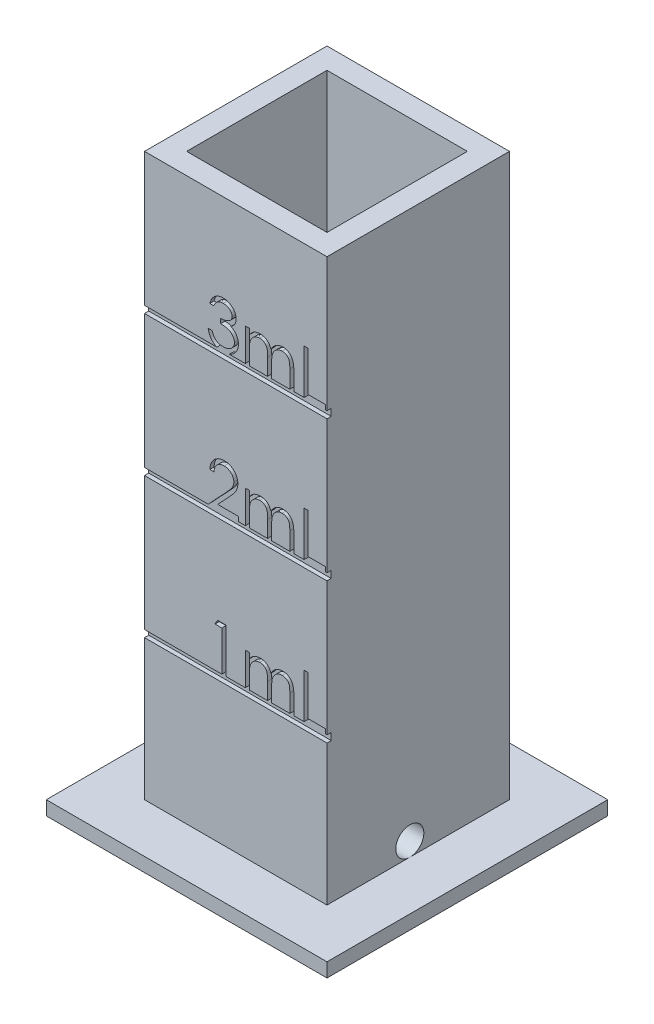
from build123d import *

# Parameters (mm, degrees)
SKETCH1_W               = 13
SKETCH1_H               = 13
SKETCH1_W_2             = 10
SKETCH1_H_2             = 10
BOSS_EXTRUDE1_DEPTH     = 40
SKETCH2_W               = 13
SKETCH2_H               = 0.5
CUT_EXTRUDE1_DEPTH      = 0.3
SKETCH3_W               = 20
SKETCH3_H               = 20
BOSS_EXTRUDE2_DEPTH     = 1
CUT_EXTRUDE3_DEPTH      = 5
CUT_EXTRUDE3_DEPTH_BACK = 21
SKETCH4_R               = 1
CUT_EXTRUDE4_DEPTH      = 0.3


with BuildPart() as part:
    # Sketch1 → Boss-Extrude1 (new body)
    with BuildSketch(Plane(origin=(0, 0, 0), x_dir=(1, 0, 0), z_dir=(0, 1, 0))):
        Rectangle(SKETCH1_W, SKETCH1_H)
        Rectangle(SKETCH1_W_2, SKETCH1_H_2, mode=Mode.SUBTRACT)
    extrude(amount=BOSS_EXTRUDE1_DEPTH)

    # Sketch2 → Cut-Extrude1 (cut)
    with BuildSketch(Plane.XY.offset(6.5)):
        with Locations((0, 10.25)):
            Rectangle(SKETCH2_W, SKETCH2_H)
        with Locations((0, 20.25)):
            Rectangle(SKETCH2_W, SKETCH2_H)
        with Locations((0, 30.25)):
            Rectangle(SKETCH2_W, SKETCH2_H)
        with Locations((0, 40.25)):
            Rectangle(SKETCH2_W, SKETCH2_H)
        with Locations((0, 50.25)):
            Rectangle(SKETCH2_W, SKETCH2_H)
        with Locations((0, 60.25)):
            Rectangle(SKETCH2_W, SKETCH2_H)
    extrude(amount=-CUT_EXTRUDE1_DEPTH, mode=Mode.SUBTRACT)

    # Sketch3 → Boss-Extrude2 (add)
    with BuildSketch(Plane.XZ):
        Rectangle(SKETCH3_W, SKETCH3_H)
    extrude(amount=BOSS_EXTRUDE2_DEPTH)

    # Sketch4 → Cut-Extrude3 (cut, two sides: drawn at the far end of the back side and taken through both)
    with BuildSketch(Plane(origin=(6.5, 0, 0), x_dir=(0, 0, -1), z_dir=(1, 0, 0)).offset(-CUT_EXTRUDE3_DEPTH_BACK)):
        with Locations(Location((-0.601324877, 1, 0), (0, 0, 270))):
            Circle(SKETCH4_R)
    extrude(amount=CUT_EXTRUDE3_DEPTH + CUT_EXTRUDE3_DEPTH_BACK, mode=Mode.SUBTRACT)

    # Sketch5 → Cut-Extrude4 (cut)
    with BuildSketch(Plane.XY.offset(6.5)):
        Polygon((4.871794872, 13.675), (5.156730769, 13.675), (5.156730769, 10.825641026), (6.377884615, 10.825641026), (6.377884615, 10.5), (4.871794872, 10.5), align=None)
        with BuildLine():
            Line((0.679166667, 12.820192308), (0.964102564, 12.820192308))
            Line((0.964102564, 12.820192308), (0.964102564, 12.416957131))
            add(Edge.make_bspline(
                [(0.964102564, 12.416957131), (0.989760147, 12.452233742), (1.038922536, 12.519827109), (1.119536378, 12.608899724), (1.200068995, 12.684490264), (1.258065705, 12.724171297), (1.285927484, 12.743234175)],
                knots=[0, 0, 0, 0, 1.134379233, 2.173579362, 3.122582517, 4, 4, 4, 4], degree=3))
            add(Edge.make_bspline(
                [(1.285927484, 12.743234175), (1.323904713, 12.761381899), (1.399195665, 12.797360285), (1.518411676, 12.833857871), (1.640399412, 12.85628707), (1.722775435, 12.859354459), (1.76421274, 12.860897436)],
                knots=[0, 0, 0, 0, 1.014936303, 2.012140481, 3.000054389, 4, 4, 4, 4], degree=3))
            add(Edge.make_bspline(
                [(1.76421274, 12.860897436), (1.792237102, 12.859949208), (1.847695805, 12.858072715), (1.929868516, 12.845862541), (2.009568828, 12.824756798), (2.08632584, 12.795358726), (2.158643885, 12.759756374), (2.224946229, 12.71798271), (2.28447676, 12.671086078), (2.337205393, 12.61694876), (2.384620866, 12.55405056), (2.428235248, 12.480695134), (2.468535262, 12.395235327), (2.490870306, 12.333217108), (2.502629207, 12.300565905)],
                knots=[0, 0, 0, 0, 1.009824226, 1.998387844, 2.986035974, 3.974953746, 4.955485308, 5.885931332, 6.793869504, 7.679848016, 8.601185859, 9.625726857, 10.749998409, 12, 12, 12, 12], degree=3))
            add(Edge.make_bspline(
                [(2.502629207, 12.300565905), (2.51506727, 12.322994486), (2.539543633, 12.367130782), (2.580642318, 12.429595063), (2.623702391, 12.488021224), (2.669090824, 12.542455623), (2.716647413, 12.59262945), (2.766595969, 12.63870859), (2.818652164, 12.680890926), (2.891035124, 12.730169792), (2.98520799, 12.782513007), (3.103942208, 12.827895953), (3.227449864, 12.855941298), (3.311285918, 12.859234474), (3.353620793, 12.860897436)],
                knots=[0, 0, 0, 0, 0.86119277, 1.694706429, 2.50939023, 3.298075842, 4.073795165, 4.829715201, 5.57930267, 6.321991688, 7.768977793, 9.186738141, 10.579381044, 12, 12, 12, 12], degree=3))
            add(Edge.make_bspline(
                [(3.353620793, 12.860897436), (3.392520406, 12.859430386), (3.468650725, 12.856559226), (3.579482959, 12.834013575), (3.682844454, 12.795298852), (3.77852723, 12.742472625), (3.864850775, 12.676088651), (3.939886284, 12.597104777), (4.003177971, 12.506079683), (4.044524308, 12.420452665), (4.072568869, 12.344855613), (4.089860132, 12.280442763), (4.105136141, 12.20954814), (4.117819128, 12.132086974), (4.127088814, 12.047785637), (4.133956535, 11.956782085), (4.138604801, 11.859005591), (4.138933253, 11.791545459), (4.139102564, 11.756770833)],
                knots=[0, 0, 0, 0, 1.209669288, 2.367440248, 3.500751976, 4.631527125, 5.755587489, 6.87532382, 8.007944318, 9.190864318, 9.82315674, 10.514484317, 11.263564316, 12.079023757, 12.955305781, 13.901327259, 14.918167583, 16, 16, 16, 16], degree=3))
            Line((4.139102564, 11.756770833), (4.139102564, 10.5))
            Line((4.139102564, 10.5), (3.854166667, 10.5))
            Line((3.854166667, 10.5), (3.854166667, 11.758042869))
            add(Edge.make_bspline(
                [(3.854166667, 11.758042869), (3.854096016, 11.787725104), (3.853960235, 11.844769845), (3.851516727, 11.926641711), (3.846912692, 12.001270864), (3.841529127, 12.068555544), (3.834050814, 12.128652659), (3.824393433, 12.181441496), (3.814162966, 12.227337311), (3.797166746, 12.278215368), (3.76999973, 12.334340488), (3.728618158, 12.394868303), (3.676484562, 12.447555886), (3.61628642, 12.493292502), (3.547753188, 12.530479591), (3.472220189, 12.557037114), (3.390156371, 12.573477153), (3.333348556, 12.575115467), (3.304011418, 12.575961538)],
                knots=[0, 0, 0, 0, 1.253487763, 2.409012846, 3.458416907, 4.410876679, 5.259312806, 6.014470957, 6.676830364, 7.243083969, 8.276244668, 9.299465089, 10.325150304, 11.392391894, 12.482080715, 13.603491619, 14.762376348, 16, 16, 16, 16], degree=3))
            add(Edge.make_bspline(
                [(3.304011418, 12.575961538), (3.268025103, 12.574676881), (3.196902462, 12.572137911), (3.093084056, 12.546217326), (2.993324634, 12.507137384), (2.900600906, 12.450502227), (2.815304268, 12.382640354), (2.741916794, 12.301950363), (2.681290454, 12.210664644), (2.640238633, 12.126167278), (2.614304052, 12.05026714), (2.597179993, 11.983957381), (2.583860059, 11.90859053), (2.571368222, 11.824673021), (2.563215069, 11.731627214), (2.555805188, 11.629883522), (2.55233912, 11.51913593), (2.551854289, 11.442367434), (2.551602564, 11.402509014)],
                knots=[0, 0, 0, 0, 1.090531906, 2.155305635, 3.229839962, 4.33261226, 5.44038871, 6.529323825, 7.629011124, 8.757537029, 9.370236727, 10.061839251, 10.834451254, 11.692844982, 12.636905849, 13.66920014, 14.789842145, 16, 16, 16, 16], degree=3))
            Line((2.551602564, 11.402509014), (2.551602564, 10.5))
            Line((2.551602564, 10.5), (2.266666667, 10.5))
            Line((2.266666667, 10.5), (2.266666667, 11.6798127))
            add(Edge.make_bspline(
                [(2.266666667, 11.6798127), (2.266594611, 11.713098782), (2.266455984, 11.777137859), (2.264028182, 11.868971264), (2.25941389, 11.952501958), (2.254079392, 12.027632857), (2.246404802, 12.09422742), (2.237687375, 12.152642665), (2.227392564, 12.202732146), (2.210347454, 12.257671788), (2.184299329, 12.318197197), (2.142399977, 12.382732266), (2.090141672, 12.439218326), (2.028845235, 12.487440905), (1.959897223, 12.527302106), (1.883712281, 12.556022023), (1.800976396, 12.572735486), (1.743937334, 12.574865908), (1.714603365, 12.575961538)],
                knots=[0, 0, 0, 0, 1.320475261, 2.540461679, 3.643808994, 4.639130445, 5.527981419, 6.302341397, 6.981980563, 7.553956391, 8.582137848, 9.585246428, 10.591171744, 11.620968678, 12.668337649, 13.738356861, 14.836885341, 16, 16, 16, 16], degree=3))
            add(Edge.make_bspline(
                [(1.714603365, 12.575961538), (1.680117231, 12.574573193), (1.611387589, 12.571806269), (1.510420802, 12.54690132), (1.412915932, 12.507890481), (1.320428455, 12.453770502), (1.235452621, 12.386733481), (1.161059407, 12.307889254), (1.098518687, 12.218219059), (1.057033398, 12.134612676), (1.030274068, 12.060614063), (1.0124983, 11.997702846), (0.997222354, 11.927852621), (0.985870348, 11.850847884), (0.974911686, 11.767190177), (0.969622762, 11.676462747), (0.964477845, 11.578743425), (0.964230726, 11.511276902), (0.964102564, 11.476287059)],
                knots=[0, 0, 0, 0, 1.098833095, 2.189935336, 3.297829714, 4.440610912, 5.596351641, 6.740013378, 7.886572111, 9.072425424, 9.705826452, 10.395263256, 11.156850408, 11.985370555, 12.878090359, 13.847760091, 14.883794034, 16, 16, 16, 16], degree=3))
            Line((0.964102564, 11.476287059), (0.964102564, 10.5))
            Line((0.964102564, 10.5), (0.679166667, 10.5))
            Line((0.679166667, 10.5), (0.679166667, 12.820192308))
        make_face()
        Polygon((-1.291851963, 13.675), (-0.704807692, 13.675), (-0.704807692, 10.5), (-0.98974359, 10.5), (-0.98974359, 13.349358974), (-1.478205128, 13.349358974), align=None)
        Polygon((4.871794872, 23.675), (5.156730769, 23.675), (5.156730769, 20.825641026), (6.377884615, 20.825641026), (6.377884615, 20.5), (4.871794872, 20.5), align=None)
        with BuildLine():
            Line((0.679166667, 22.820192308), (0.964102564, 22.820192308))
            Line((0.964102564, 22.820192308), (0.964102564, 22.416957131))
            add(Edge.make_bspline(
                [(0.964102564, 22.416957131), (0.989760147, 22.452233742), (1.038922536, 22.519827109), (1.119536378, 22.608899724), (1.200068995, 22.684490264), (1.258065705, 22.724171297), (1.285927484, 22.743234175)],
                knots=[0, 0, 0, 0, 1.134379233, 2.173579362, 3.122582517, 4, 4, 4, 4], degree=3))
            add(Edge.make_bspline(
                [(1.285927484, 22.743234175), (1.323904713, 22.761381899), (1.399195665, 22.797360285), (1.518411676, 22.833857871), (1.640399412, 22.85628707), (1.722775435, 22.859354459), (1.76421274, 22.860897436)],
                knots=[0, 0, 0, 0, 1.014936303, 2.012140481, 3.000054389, 4, 4, 4, 4], degree=3))
            add(Edge.make_bspline(
                [(1.76421274, 22.860897436), (1.792237102, 22.859949208), (1.847695805, 22.858072715), (1.929868516, 22.845862541), (2.009568828, 22.824756798), (2.08632584, 22.795358726), (2.158643885, 22.759756374), (2.224946229, 22.71798271), (2.28447676, 22.671086078), (2.337205393, 22.61694876), (2.384620866, 22.55405056), (2.428235248, 22.480695134), (2.468535262, 22.395235327), (2.490870306, 22.333217108), (2.502629207, 22.300565905)],
                knots=[0, 0, 0, 0, 1.009824226, 1.998387844, 2.986035974, 3.974953746, 4.955485308, 5.885931332, 6.793869504, 7.679848016, 8.601185859, 9.625726857, 10.749998409, 12, 12, 12, 12], degree=3))
            add(Edge.make_bspline(
                [(2.502629207, 22.300565905), (2.51506727, 22.322994486), (2.539543633, 22.367130782), (2.580642318, 22.429595063), (2.623702391, 22.488021224), (2.669090824, 22.542455623), (2.716647413, 22.59262945), (2.766595969, 22.63870859), (2.818652164, 22.680890926), (2.891035124, 22.730169792), (2.98520799, 22.782513007), (3.103942208, 22.827895953), (3.227449864, 22.855941298), (3.311285918, 22.859234474), (3.353620793, 22.860897436)],
                knots=[0, 0, 0, 0, 0.86119277, 1.694706429, 2.50939023, 3.298075842, 4.073795165, 4.829715201, 5.57930267, 6.321991688, 7.768977793, 9.186738141, 10.579381044, 12, 12, 12, 12], degree=3))
            add(Edge.make_bspline(
                [(3.353620793, 22.860897436), (3.392520406, 22.859430386), (3.468650725, 22.856559226), (3.579482959, 22.834013575), (3.682844454, 22.795298852), (3.77852723, 22.742472625), (3.864850775, 22.676088651), (3.939886284, 22.597104777), (4.003177971, 22.506079683), (4.044524308, 22.420452665), (4.072568869, 22.344855613), (4.089860132, 22.280442763), (4.105136141, 22.20954814), (4.117819128, 22.132086974), (4.127088814, 22.047785637), (4.133956535, 21.956782085), (4.138604801, 21.859005591), (4.138933253, 21.791545459), (4.139102564, 21.756770833)],
                knots=[0, 0, 0, 0, 1.209669288, 2.367440248, 3.500751976, 4.631527125, 5.755587489, 6.87532382, 8.007944318, 9.190864318, 9.82315674, 10.514484317, 11.263564316, 12.079023757, 12.955305781, 13.901327259, 14.918167583, 16, 16, 16, 16], degree=3))
            Line((4.139102564, 21.756770833), (4.139102564, 20.5))
            Line((4.139102564, 20.5), (3.854166667, 20.5))
            Line((3.854166667, 20.5), (3.854166667, 21.758042869))
            add(Edge.make_bspline(
                [(3.854166667, 21.758042869), (3.854096016, 21.787725104), (3.853960235, 21.844769845), (3.851516727, 21.926641711), (3.846912692, 22.001270864), (3.841529127, 22.068555544), (3.834050814, 22.128652659), (3.824393433, 22.181441496), (3.814162966, 22.227337311), (3.797166746, 22.278215368), (3.76999973, 22.334340488), (3.728618158, 22.394868303), (3.676484562, 22.447555886), (3.61628642, 22.493292502), (3.547753188, 22.530479591), (3.472220189, 22.557037114), (3.390156371, 22.573477153), (3.333348556, 22.575115467), (3.304011418, 22.575961538)],
                knots=[0, 0, 0, 0, 1.253487763, 2.409012846, 3.458416907, 4.410876679, 5.259312806, 6.014470957, 6.676830364, 7.243083969, 8.276244668, 9.299465089, 10.325150304, 11.392391894, 12.482080715, 13.603491619, 14.762376348, 16, 16, 16, 16], degree=3))
            add(Edge.make_bspline(
                [(3.304011418, 22.575961538), (3.268025103, 22.574676881), (3.196902462, 22.572137911), (3.093084056, 22.546217326), (2.993324634, 22.507137384), (2.900600906, 22.450502227), (2.815304268, 22.382640354), (2.741916794, 22.301950363), (2.681290454, 22.210664644), (2.640238633, 22.126167278), (2.614304052, 22.05026714), (2.597179993, 21.983957381), (2.583860059, 21.90859053), (2.571368222, 21.824673021), (2.563215069, 21.731627214), (2.555805188, 21.629883522), (2.55233912, 21.51913593), (2.551854289, 21.442367434), (2.551602564, 21.402509014)],
                knots=[0, 0, 0, 0, 1.090531906, 2.155305635, 3.229839962, 4.33261226, 5.44038871, 6.529323825, 7.629011124, 8.757537029, 9.370236727, 10.061839251, 10.834451254, 11.692844982, 12.636905849, 13.66920014, 14.789842145, 16, 16, 16, 16], degree=3))
            Line((2.551602564, 21.402509014), (2.551602564, 20.5))
            Line((2.551602564, 20.5), (2.266666667, 20.5))
            Line((2.266666667, 20.5), (2.266666667, 21.6798127))
            add(Edge.make_bspline(
                [(2.266666667, 21.6798127), (2.266594611, 21.713098782), (2.266455984, 21.777137859), (2.264028182, 21.868971264), (2.25941389, 21.952501958), (2.254079392, 22.027632857), (2.246404802, 22.09422742), (2.237687375, 22.152642665), (2.227392564, 22.202732146), (2.210347454, 22.257671788), (2.184299329, 22.318197197), (2.142399977, 22.382732266), (2.090141672, 22.439218326), (2.028845235, 22.487440905), (1.959897223, 22.527302106), (1.883712281, 22.556022023), (1.800976396, 22.572735486), (1.743937334, 22.574865908), (1.714603365, 22.575961538)],
                knots=[0, 0, 0, 0, 1.320475261, 2.540461679, 3.643808994, 4.639130445, 5.527981419, 6.302341397, 6.981980563, 7.553956391, 8.582137848, 9.585246428, 10.591171744, 11.620968678, 12.668337649, 13.738356861, 14.836885341, 16, 16, 16, 16], degree=3))
            add(Edge.make_bspline(
                [(1.714603365, 22.575961538), (1.680117231, 22.574573193), (1.611387589, 22.571806269), (1.510420802, 22.54690132), (1.412915932, 22.507890481), (1.320428455, 22.453770502), (1.235452621, 22.386733481), (1.161059407, 22.307889254), (1.098518687, 22.218219059), (1.057033398, 22.134612676), (1.030274068, 22.060614063), (1.0124983, 21.997702846), (0.997222354, 21.927852621), (0.985870348, 21.850847884), (0.974911686, 21.767190177), (0.969622762, 21.676462747), (0.964477845, 21.578743425), (0.964230726, 21.511276902), (0.964102564, 21.476287059)],
                knots=[0, 0, 0, 0, 1.098833095, 2.189935336, 3.297829714, 4.440610912, 5.596351641, 6.740013378, 7.886572111, 9.072425424, 9.705826452, 10.395263256, 11.156850408, 11.985370555, 12.878090359, 13.847760091, 14.883794034, 16, 16, 16, 16], degree=3))
            Line((0.964102564, 21.476287059), (0.964102564, 20.5))
            Line((0.964102564, 20.5), (0.679166667, 20.5))
            Line((0.679166667, 20.5), (0.679166667, 22.820192308))
        make_face()
        with BuildLine():
            Line((-1.559615385, 22.698076923), (-1.844551282, 22.698076923))
            add(Edge.make_bspline(
                [(-1.844551282, 22.698076923), (-1.842694222, 22.735878371), (-1.839047005, 22.810119409), (-1.821967057, 22.918363239), (-1.797527833, 23.021827235), (-1.762973442, 23.119680657), (-1.72005989, 23.212788718), (-1.668597651, 23.300781589), (-1.607643229, 23.383323596), (-1.538512835, 23.459649547), (-1.463429855, 23.5296697), (-1.38241661, 23.590135528), (-1.297285764, 23.641223701), (-1.208295595, 23.683933113), (-1.114442084, 23.715991402), (-1.01657692, 23.739778175), (-0.914270132, 23.754089574), (-0.844565255, 23.755627894), (-0.809114583, 23.756410256)],
                knots=[0, 0, 0, 0, 1.10065271, 2.161652631, 3.183658789, 4.190468796, 5.17591951, 6.163126047, 7.15150782, 8.156236427, 9.156009102, 10.134482811, 11.092018607, 12.041330605, 13.001268258, 13.972401359, 14.968799086, 16, 16, 16, 16], degree=3))
            add(Edge.make_bspline(
                [(-0.809114583, 23.756410256), (-0.774300188, 23.755595228), (-0.705891143, 23.753993726), (-0.606049173, 23.740240507), (-0.511001199, 23.718699863), (-0.420933011, 23.688478021), (-0.336563224, 23.647852148), (-0.257258033, 23.599050095), (-0.182073298, 23.542607819), (-0.114394287, 23.476156146), (-0.052247672, 23.405215411), (0.001366516, 23.329479956), (0.047279886, 23.251257675), (0.085550139, 23.169952092), (0.113722493, 23.084797659), (0.135111296, 22.997034125), (0.147201164, 22.905753047), (0.149056656, 22.843970671), (0.15, 22.812560096)],
                knots=[0, 0, 0, 0, 1.111607364, 2.184268762, 3.212621178, 4.221274766, 5.211760367, 6.196651075, 7.1921475, 8.207485113, 9.220403448, 10.201281604, 11.166441695, 12.114753415, 13.065576456, 14.026450734, 14.996634279, 16, 16, 16, 16], degree=3))
            add(Edge.make_bspline(
                [(0.15, 22.812560096), (0.148463969, 22.768338846), (0.145418861, 22.680672367), (0.11937082, 22.551844598), (0.078688627, 22.427027711), (0.029705311, 22.326573158), (-0.019708978, 22.245625632), (-0.06423836, 22.178979021), (-0.116367152, 22.10721906), (-0.176854076, 22.030586047), (-0.244447895, 21.948479726), (-0.319760858, 21.860949697), (-0.403330016, 21.768900306), (-0.461984514, 21.706030225), (-0.492377804, 21.673452524)],
                knots=[0, 0, 0, 0, 1.184426356, 2.348067706, 3.509069118, 4.696110526, 5.333549288, 6.050745305, 6.844228056, 7.710549037, 8.667450064, 9.695053472, 10.805634456, 12, 12, 12, 12], degree=3))
            Line((-0.492377804, 21.673452524), (-1.286763822, 20.825641026))
            Line((-1.286763822, 20.825641026), (0.190705128, 20.825641026))
            Line((0.190705128, 20.825641026), (0.190705128, 20.5))
            Line((0.190705128, 20.5), (-1.966666667, 20.5))
            Line((-1.966666667, 20.5), (-0.735336538, 21.81401242))
            add(Edge.make_bspline(
                [(-0.735336538, 21.81401242), (-0.705357384, 21.845307312), (-0.647773564, 21.905418396), (-0.56632794, 21.993178081), (-0.493176858, 22.074593736), (-0.427846795, 22.149511533), (-0.371754972, 22.219027313), (-0.321978019, 22.280889651), (-0.282094947, 22.337816902), (-0.238810267, 22.403803031), (-0.196887583, 22.48436849), (-0.160862803, 22.582824051), (-0.138896476, 22.68417663), (-0.136261376, 22.752667764), (-0.134935897, 22.787119391)],
                knots=[0, 0, 0, 0, 1.329631726, 2.553950428, 3.673215718, 4.687767853, 5.603093632, 6.413772471, 7.123043292, 7.734684054, 8.834405432, 9.900288307, 10.943827018, 12, 12, 12, 12], degree=3))
            add(Edge.make_bspline(
                [(-0.134935897, 22.787119391), (-0.135512607, 22.808783231), (-0.136649189, 22.8514785), (-0.146680101, 22.914076581), (-0.161838917, 22.974460376), (-0.183560687, 23.032815624), (-0.212232515, 23.088555608), (-0.247133367, 23.141748179), (-0.287401496, 23.193173169), (-0.333984433, 23.241390804), (-0.38515774, 23.285551612), (-0.439218238, 23.324671318), (-0.49641369, 23.35736394), (-0.556502944, 23.384164112), (-0.619318477, 23.405187494), (-0.684981781, 23.419754919), (-0.753311424, 23.428901173), (-0.799968953, 23.430138671), (-0.823742989, 23.430769231)],
                knots=[0, 0, 0, 0, 0.991446411, 1.95395049, 2.89581595, 3.838931463, 4.798493298, 5.75982156, 6.748411868, 7.785213223, 8.824556874, 9.840280684, 10.836137867, 11.835679398, 12.848801643, 13.863922112, 14.911575587, 16, 16, 16, 16], degree=3))
            add(Edge.make_bspline(
                [(-0.823742989, 23.430769231), (-0.848572244, 23.430120594), (-0.897332802, 23.42884678), (-0.968923639, 23.41993622), (-1.037218595, 23.404563922), (-1.102389464, 23.383539367), (-1.164546517, 23.356816255), (-1.223387471, 23.323531601), (-1.278780235, 23.283813718), (-1.330828938, 23.238782642), (-1.378784119, 23.188647032), (-1.420918071, 23.132757994), (-1.457733569, 23.072135982), (-1.489854802, 23.006944568), (-1.515940321, 22.936592211), (-1.535873108, 22.86132865), (-1.551645461, 22.781480682), (-1.556914619, 22.726339927), (-1.559615385, 22.698076923)],
                knots=[0, 0, 0, 0, 1.031018746, 2.02475058, 2.990194455, 3.934040569, 4.864654155, 5.795059489, 6.735614925, 7.690564532, 8.649604399, 9.611025574, 10.590972636, 11.591080095, 12.624614302, 13.701020113, 14.821632451, 16, 16, 16, 16], degree=3))
        make_face()
        Polygon((4.871794872, 33.675), (5.156730769, 33.675), (5.156730769, 30.825641026), (6.377884615, 30.825641026), (6.377884615, 30.5), (4.871794872, 30.5), align=None)
        with BuildLine():
            Line((0.679166667, 32.820192308), (0.964102564, 32.820192308))
            Line((0.964102564, 32.820192308), (0.964102564, 32.416957131))
            add(Edge.make_bspline(
                [(0.964102564, 32.416957131), (0.989760147, 32.452233742), (1.038922536, 32.519827109), (1.119536378, 32.608899724), (1.200068995, 32.684490264), (1.258065705, 32.724171297), (1.285927484, 32.743234175)],
                knots=[0, 0, 0, 0, 1.134379233, 2.173579362, 3.122582517, 4, 4, 4, 4], degree=3))
            add(Edge.make_bspline(
                [(1.285927484, 32.743234175), (1.323904713, 32.761381899), (1.399195665, 32.797360285), (1.518411676, 32.833857871), (1.640399412, 32.85628707), (1.722775435, 32.859354459), (1.76421274, 32.860897436)],
                knots=[0, 0, 0, 0, 1.014936303, 2.012140481, 3.000054389, 4, 4, 4, 4], degree=3))
            add(Edge.make_bspline(
                [(1.76421274, 32.860897436), (1.792237102, 32.859949208), (1.847695805, 32.858072715), (1.929868516, 32.845862541), (2.009568828, 32.824756798), (2.08632584, 32.795358726), (2.158643885, 32.759756374), (2.224946229, 32.71798271), (2.28447676, 32.671086078), (2.337205393, 32.61694876), (2.384620866, 32.55405056), (2.428235248, 32.480695134), (2.468535262, 32.395235327), (2.490870306, 32.333217108), (2.502629207, 32.300565905)],
                knots=[0, 0, 0, 0, 1.009824226, 1.998387844, 2.986035974, 3.974953746, 4.955485308, 5.885931332, 6.793869504, 7.679848016, 8.601185859, 9.625726857, 10.749998409, 12, 12, 12, 12], degree=3))
            add(Edge.make_bspline(
                [(2.502629207, 32.300565905), (2.51506727, 32.322994486), (2.539543633, 32.367130782), (2.580642318, 32.429595063), (2.623702391, 32.488021224), (2.669090824, 32.542455623), (2.716647413, 32.59262945), (2.766595969, 32.63870859), (2.818652164, 32.680890926), (2.891035124, 32.730169792), (2.98520799, 32.782513007), (3.103942208, 32.827895953), (3.227449864, 32.855941298), (3.311285918, 32.859234474), (3.353620793, 32.860897436)],
                knots=[0, 0, 0, 0, 0.86119277, 1.694706429, 2.50939023, 3.298075842, 4.073795165, 4.829715201, 5.57930267, 6.321991688, 7.768977793, 9.186738141, 10.579381044, 12, 12, 12, 12], degree=3))
            add(Edge.make_bspline(
                [(3.353620793, 32.860897436), (3.392520406, 32.859430386), (3.468650725, 32.856559226), (3.579482959, 32.834013575), (3.682844454, 32.795298852), (3.77852723, 32.742472625), (3.864850775, 32.676088651), (3.939886284, 32.597104777), (4.003177971, 32.506079683), (4.044524308, 32.420452665), (4.072568869, 32.344855613), (4.089860132, 32.280442763), (4.105136141, 32.20954814), (4.117819128, 32.132086974), (4.127088814, 32.047785637), (4.133956535, 31.956782085), (4.138604801, 31.859005591), (4.138933253, 31.791545459), (4.139102564, 31.756770833)],
                knots=[0, 0, 0, 0, 1.209669288, 2.367440248, 3.500751976, 4.631527125, 5.755587489, 6.87532382, 8.007944318, 9.190864318, 9.82315674, 10.514484317, 11.263564316, 12.079023757, 12.955305781, 13.901327259, 14.918167583, 16, 16, 16, 16], degree=3))
            Line((4.139102564, 31.756770833), (4.139102564, 30.5))
            Line((4.139102564, 30.5), (3.854166667, 30.5))
            Line((3.854166667, 30.5), (3.854166667, 31.758042869))
            add(Edge.make_bspline(
                [(3.854166667, 31.758042869), (3.854096016, 31.787725104), (3.853960235, 31.844769845), (3.851516727, 31.926641711), (3.846912692, 32.001270864), (3.841529127, 32.068555544), (3.834050814, 32.128652659), (3.824393433, 32.181441496), (3.814162966, 32.227337311), (3.797166746, 32.278215368), (3.76999973, 32.334340488), (3.728618158, 32.394868303), (3.676484562, 32.447555886), (3.61628642, 32.493292502), (3.547753188, 32.530479591), (3.472220189, 32.557037114), (3.390156371, 32.573477153), (3.333348556, 32.575115467), (3.304011418, 32.575961538)],
                knots=[0, 0, 0, 0, 1.253487763, 2.409012846, 3.458416907, 4.410876679, 5.259312806, 6.014470957, 6.676830364, 7.243083969, 8.276244668, 9.299465089, 10.325150304, 11.392391894, 12.482080715, 13.603491619, 14.762376348, 16, 16, 16, 16], degree=3))
            add(Edge.make_bspline(
                [(3.304011418, 32.575961538), (3.268025103, 32.574676881), (3.196902462, 32.572137911), (3.093084056, 32.546217326), (2.993324634, 32.507137384), (2.900600906, 32.450502227), (2.815304268, 32.382640354), (2.741916794, 32.301950363), (2.681290454, 32.210664644), (2.640238633, 32.126167278), (2.614304052, 32.05026714), (2.597179993, 31.983957381), (2.583860059, 31.90859053), (2.571368222, 31.824673021), (2.563215069, 31.731627214), (2.555805188, 31.629883522), (2.55233912, 31.51913593), (2.551854289, 31.442367434), (2.551602564, 31.402509014)],
                knots=[0, 0, 0, 0, 1.090531906, 2.155305635, 3.229839962, 4.33261226, 5.44038871, 6.529323825, 7.629011124, 8.757537029, 9.370236727, 10.061839251, 10.834451254, 11.692844982, 12.636905849, 13.66920014, 14.789842145, 16, 16, 16, 16], degree=3))
            Line((2.551602564, 31.402509014), (2.551602564, 30.5))
            Line((2.551602564, 30.5), (2.266666667, 30.5))
            Line((2.266666667, 30.5), (2.266666667, 31.6798127))
            add(Edge.make_bspline(
                [(2.266666667, 31.6798127), (2.266594611, 31.713098782), (2.266455984, 31.777137859), (2.264028182, 31.868971264), (2.25941389, 31.952501958), (2.254079392, 32.027632857), (2.246404802, 32.09422742), (2.237687375, 32.152642665), (2.227392564, 32.202732146), (2.210347454, 32.257671788), (2.184299329, 32.318197197), (2.142399977, 32.382732266), (2.090141672, 32.439218326), (2.028845235, 32.487440905), (1.959897223, 32.527302106), (1.883712281, 32.556022023), (1.800976396, 32.572735486), (1.743937334, 32.574865908), (1.714603365, 32.575961538)],
                knots=[0, 0, 0, 0, 1.320475261, 2.540461679, 3.643808994, 4.639130445, 5.527981419, 6.302341397, 6.981980563, 7.553956391, 8.582137848, 9.585246428, 10.591171744, 11.620968678, 12.668337649, 13.738356861, 14.836885341, 16, 16, 16, 16], degree=3))
            add(Edge.make_bspline(
                [(1.714603365, 32.575961538), (1.680117231, 32.574573193), (1.611387589, 32.571806269), (1.510420802, 32.54690132), (1.412915932, 32.507890481), (1.320428455, 32.453770502), (1.235452621, 32.386733481), (1.161059407, 32.307889254), (1.098518687, 32.218219059), (1.057033398, 32.134612676), (1.030274068, 32.060614063), (1.0124983, 31.997702846), (0.997222354, 31.927852621), (0.985870348, 31.850847884), (0.974911686, 31.767190177), (0.969622762, 31.676462747), (0.964477845, 31.578743425), (0.964230726, 31.511276902), (0.964102564, 31.476287059)],
                knots=[0, 0, 0, 0, 1.098833095, 2.189935336, 3.297829714, 4.440610912, 5.596351641, 6.740013378, 7.886572111, 9.072425424, 9.705826452, 10.395263256, 11.156850408, 11.985370555, 12.878090359, 13.847760091, 14.883794034, 16, 16, 16, 16], degree=3))
            Line((0.964102564, 31.476287059), (0.964102564, 30.5))
            Line((0.964102564, 30.5), (0.679166667, 30.5))
            Line((0.679166667, 30.5), (0.679166667, 32.820192308))
        make_face()
        with BuildLine():
            Line((-1.559615385, 32.942307692), (-1.844551282, 32.942307692))
            add(Edge.make_bspline(
                [(-1.844551282, 32.942307692), (-1.836831904, 32.974268588), (-1.821741151, 33.036749526), (-1.790265495, 33.12601897), (-1.755976171, 33.210495307), (-1.714801769, 33.288596746), (-1.669890256, 33.361892893), (-1.618434644, 33.428721313), (-1.562808896, 33.490781646), (-1.501281978, 33.545857226), (-1.43675812, 33.59572988), (-1.368328144, 33.638252254), (-1.297368805, 33.674832021), (-1.223388463, 33.704967517), (-1.146166864, 33.727669242), (-1.066402134, 33.744140059), (-0.983885245, 33.754836284), (-0.927871359, 33.75588019), (-0.899429087, 33.756410256)],
                knots=[0, 0, 0, 0, 1.162005537, 2.271625781, 3.343758855, 4.383309926, 5.390229558, 6.379919256, 7.361854164, 8.333198761, 9.295911338, 10.242430842, 11.177959212, 12.116337295, 13.062827104, 14.020064771, 14.994644689, 16, 16, 16, 16], degree=3))
            add(Edge.make_bspline(
                [(-0.899429087, 33.756410256), (-0.857988313, 33.755159098), (-0.776010711, 33.752684071), (-0.655575661, 33.730083118), (-0.539437046, 33.694318891), (-0.428866086, 33.644903438), (-0.326160793, 33.583954947), (-0.234778681, 33.511415507), (-0.155958389, 33.428684712), (-0.089832775, 33.337305886), (-0.038057597, 33.23964696), (0.000120756, 33.139135389), (0.02336328, 33.0360096), (0.0263755, 32.966379783), (0.027884615, 32.931495393)],
                knots=[0, 0, 0, 0, 1.083050992, 2.142477498, 3.193116406, 4.255571735, 5.30263384, 6.308962982, 7.297363603, 8.282367274, 9.249857812, 10.179914175, 11.08814088, 12, 12, 12, 12], degree=3))
            add(Edge.make_bspline(
                [(0.027884615, 32.931495393), (0.026829072, 32.897924943), (0.024763538, 32.832232783), (0.007225105, 32.736328282), (-0.022289934, 32.645939116), (-0.063174647, 32.560684776), (-0.116098768, 32.481105814), (-0.180209, 32.407023185), (-0.255957843, 32.338108306), (-0.31336088, 32.298629927), (-0.342913662, 32.278305288)],
                knots=[0, 0, 0, 0, 1.024540389, 2.004866551, 2.965041327, 3.920577974, 4.882998113, 5.874504559, 6.905732034, 8, 8, 8, 8], degree=3))
            add(Edge.make_bspline(
                [(-0.342913662, 32.278305288), (-0.309139142, 32.261996519), (-0.242222049, 32.229684128), (-0.151008354, 32.166314977), (-0.068206281, 32.093148148), (-0.022029336, 32.03605017), (0.001171875, 32.007361779)],
                knots=[0, 0, 0, 0, 1.015518401, 2.012035669, 3.001164323, 4, 4, 4, 4], degree=3))
            add(Edge.make_bspline(
                [(0.001171875, 32.007361779), (0.016449378, 31.986445104), (0.046754206, 31.94495428), (0.084160725, 31.878246236), (0.118096136, 31.810798814), (0.14453955, 31.74080421), (0.165017272, 31.66907369), (0.179654958, 31.595484088), (0.188748286, 31.519975311), (0.190050537, 31.468891847), (0.190705128, 31.443214143)],
                knots=[0, 0, 0, 0, 1.025084078, 2.033381695, 3.024893161, 4.013698104, 4.991890475, 5.976764909, 6.982997093, 8, 8, 8, 8], degree=3))
            add(Edge.make_bspline(
                [(0.190705128, 31.443214143), (0.189077248, 31.398755324), (0.185829149, 31.310046911), (0.156796881, 31.178987699), (0.111790584, 31.050875994), (0.047876078, 30.928343818), (-0.030018019, 30.813698758), (-0.122689306, 30.711122392), (-0.229084834, 30.622949372), (-0.347744244, 30.549280094), (-0.476301925, 30.490390265), (-0.61380264, 30.449516727), (-0.758265189, 30.422895713), (-0.857331809, 30.420041054), (-0.907697316, 30.418589744)],
                knots=[0, 0, 0, 0, 0.955779014, 1.907060117, 2.875433937, 3.871313158, 4.872415639, 5.851225146, 6.836215519, 7.83643374, 8.849228613, 9.86973379, 10.916971861, 12, 12, 12, 12], degree=3))
            add(Edge.make_bspline(
                [(-0.907697316, 30.418589744), (-0.941641967, 30.419377337), (-1.008433721, 30.420927058), (-1.106626037, 30.431521218), (-1.200353579, 30.45087058), (-1.289743071, 30.476908578), (-1.374873925, 30.509921087), (-1.455486364, 30.55103162), (-1.532076338, 30.599392769), (-1.603921101, 30.655575381), (-1.671012088, 30.718423453), (-1.731566345, 30.789052698), (-1.786593443, 30.866157486), (-1.834619979, 30.950633401), (-1.8778335, 31.041388741), (-1.913376225, 31.139585593), (-1.944659563, 31.244346099), (-1.959204205, 31.317350906), (-1.966666667, 31.354807692)],
                knots=[0, 0, 0, 0, 1.048658725, 2.063410685, 3.046034179, 4.001477787, 4.936774919, 5.862367409, 6.792675028, 7.730719943, 8.675894397, 9.627829632, 10.600096036, 11.597688215, 12.626045268, 13.701542398, 14.82072376, 16, 16, 16, 16], degree=3))
            Line((-1.966666667, 31.354807692), (-1.681730769, 31.354807692))
            add(Edge.make_bspline(
                [(-1.681730769, 31.354807692), (-1.674307355, 31.330361087), (-1.659868169, 31.282810317), (-1.63528977, 31.214375183), (-1.607287838, 31.151638949), (-1.577248202, 31.094141403), (-1.545699183, 31.041316295), (-1.510397787, 30.994560456), (-1.473958634, 30.951820237), (-1.446490935, 30.927740482), (-1.433047877, 30.915955529)],
                knots=[0, 0, 0, 0, 1.198163088, 2.33053128, 3.407730985, 4.417276592, 5.372219308, 6.28897303, 7.162600585, 8, 8, 8, 8], degree=3))
            add(Edge.make_bspline(
                [(-1.433047877, 30.915955529), (-1.415270982, 30.902250112), (-1.379772067, 30.874881583), (-1.321925171, 30.839955106), (-1.261087739, 30.80969189), (-1.19594157, 30.786574537), (-1.127892457, 30.767000516), (-1.05584049, 30.754191188), (-0.980421343, 30.745402633), (-0.928924872, 30.744627088), (-0.902609175, 30.744230769)],
                knots=[0, 0, 0, 0, 0.946170439, 1.889420265, 2.845303464, 3.807233317, 4.801018734, 5.828864929, 6.890507805, 8, 8, 8, 8], degree=3))
            add(Edge.make_bspline(
                [(-0.902609175, 30.744230769), (-0.872897069, 30.744789483), (-0.81479761, 30.745882), (-0.730020702, 30.755929249), (-0.649368946, 30.770561838), (-0.573737792, 30.793161472), (-0.502136546, 30.821084102), (-0.435568907, 30.856143727), (-0.373161011, 30.897277867), (-0.315712193, 30.944031247), (-0.264054482, 30.995213603), (-0.218570781, 31.048746889), (-0.179904124, 31.104405392), (-0.148713307, 31.162497116), (-0.124083879, 31.222781502), (-0.107316975, 31.285427726), (-0.095658815, 31.349923103), (-0.094709389, 31.393764382), (-0.094230769, 31.415865385)],
                knots=[0, 0, 0, 0, 1.217147791, 2.380027433, 3.494444702, 4.572153297, 5.609568379, 6.639424714, 7.649109417, 8.668170816, 9.669597737, 10.625200337, 11.543417969, 12.441394052, 13.322311151, 14.205496177, 15.095365482, 16, 16, 16, 16], degree=3))
            add(Edge.make_bspline(
                [(-0.094230769, 31.415865385), (-0.095618971, 31.445448528), (-0.098388468, 31.504467612), (-0.119532679, 31.591297126), (-0.154311506, 31.674956936), (-0.203000141, 31.754019688), (-0.262268981, 31.827294971), (-0.331542861, 31.892674101), (-0.411397039, 31.946621969), (-0.484893635, 31.983895251), (-0.549994884, 32.009328883), (-0.605707411, 32.026269744), (-0.668079473, 32.040614988), (-0.736356804, 32.05396112), (-0.811053864, 32.065319772), (-0.892089333, 32.074791991), (-0.979479631, 32.082371206), (-1.039978046, 32.085755843), (-1.071153846, 32.0875)],
                knots=[0, 0, 0, 0, 1.07054697, 2.135767047, 3.216561865, 4.33974944, 5.486079747, 6.621378074, 7.775625952, 8.963672916, 9.598146892, 10.304877434, 11.070270905, 11.915000392, 12.823868403, 13.805723172, 14.86925407, 16, 16, 16, 16], degree=3))
            Line((-1.071153846, 32.0875), (-1.071153846, 32.413141026))
            add(Edge.make_bspline(
                [(-1.071153846, 32.413141026), (-1.031873503, 32.413807598), (-0.95493296, 32.415113248), (-0.842543126, 32.430904801), (-0.735070908, 32.45274937), (-0.634898077, 32.486209509), (-0.543595316, 32.525071778), (-0.464383963, 32.570294854), (-0.398373765, 32.620563948), (-0.345885507, 32.676654958), (-0.306398278, 32.73681218), (-0.277526826, 32.799510862), (-0.260472245, 32.865300546), (-0.258195618, 32.91019928), (-0.257051282, 32.932767428)],
                knots=[0, 0, 0, 0, 1.321986639, 2.589447074, 3.816329219, 5.01088745, 6.139805852, 7.153945165, 8.075214402, 8.924034688, 9.728124013, 10.488707548, 11.240355623, 12, 12, 12, 12], degree=3))
            add(Edge.make_bspline(
                [(-0.257051282, 32.932767428), (-0.257427212, 32.949347954), (-0.258175107, 32.982334124), (-0.267606923, 33.03052615), (-0.28178016, 33.077244866), (-0.301265343, 33.122291594), (-0.327345881, 33.165353913), (-0.358557026, 33.206798956), (-0.395720945, 33.246390099), (-0.438307172, 33.28329296), (-0.484037881, 33.318462197), (-0.53415732, 33.348319567), (-0.587154306, 33.373851159), (-0.643087514, 33.394905493), (-0.70213846, 33.410743562), (-0.764029694, 33.422115361), (-0.828879236, 33.429225234), (-0.873122164, 33.430248868), (-0.895612981, 33.430769231)],
                knots=[0, 0, 0, 0, 0.884392785, 1.759457502, 2.611959086, 3.489218968, 4.37281399, 5.2945488, 6.255912374, 7.266815255, 8.301784654, 9.332968512, 10.37626691, 11.440494194, 12.520033166, 13.637162961, 14.798855837, 16, 16, 16, 16], degree=3))
            add(Edge.make_bspline(
                [(-0.895612981, 33.430769231), (-0.931764137, 33.429507067), (-1.002375752, 33.427041767), (-1.104170713, 33.405449033), (-1.198803252, 33.370997486), (-1.271137613, 33.329873961), (-1.32455252, 33.289278925), (-1.362722314, 33.253825617), (-1.40020592, 33.214425841), (-1.434537355, 33.168652887), (-1.46925732, 33.119606584), (-1.500866315, 33.064793673), (-1.531581893, 33.005643972), (-1.55008992, 32.963828647), (-1.559615385, 32.942307692)],
                knots=[0, 0, 0, 0, 1.472543308, 2.876219568, 4.221790263, 5.565193594, 6.249813518, 6.953379497, 7.687249741, 8.463570142, 9.283606569, 10.136032583, 11.040678096, 12, 12, 12, 12], degree=3))
        make_face()
    extrude(amount=-CUT_EXTRUDE4_DEPTH, mode=Mode.SUBTRACT)


solid = part.part
